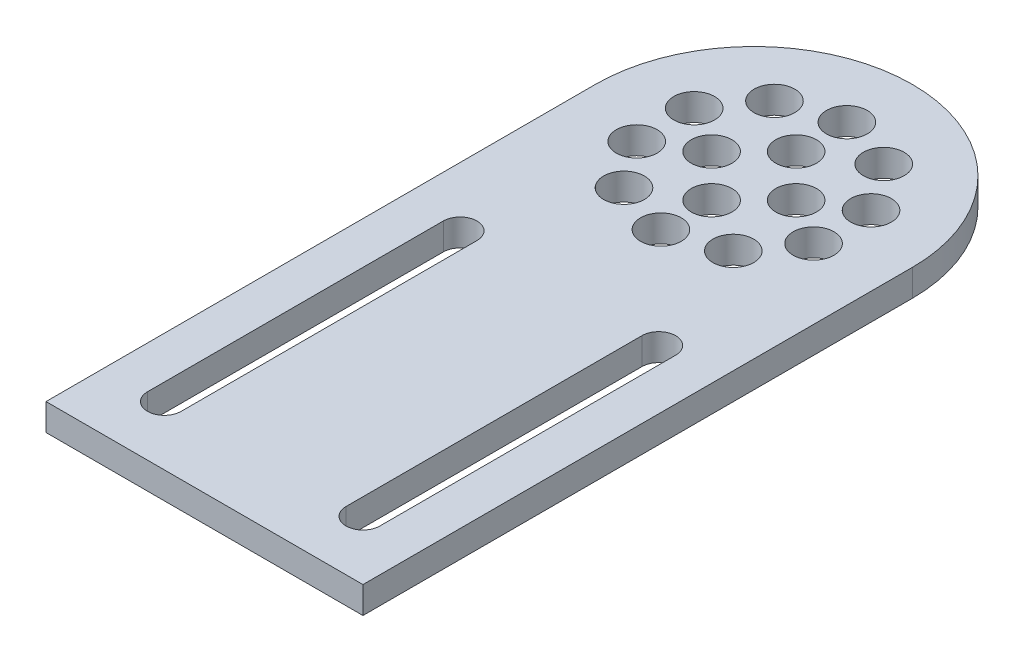
from build123d import *

# Parameters (mm, degrees)
SKETCH1_R           = 4.825
BOSS_EXTRUDE1_DEPTH = 6.35
CUT_EXTRUDE1_DEPTH  = 136.449520117


with BuildPart() as part:
    # Sketch1 → Boss-Extrude1 (new body)
    with BuildSketch(Plane(origin=(0, 0, 0), x_dir=(1, 0, 0), z_dir=(0, 1, 0))):
        with BuildLine():
            Line((-37.5, 0), (-37.5, -130))
            Line((-37.5, -130), (37.5, -130))
            Line((37.5, -130), (37.5, 0))
            ThreePointArc((37.5, 0), (0, 37.5), (-37.5, 0))
        make_face()
        with Locations(Location((0, 22, 0), (0, 0, 270))):
            Circle(SKETCH1_R, mode=Mode.SUBTRACT)
        with Locations(Location((0, 10, 0), (0, 0, 270))):
            Circle(SKETCH1_R, mode=Mode.SUBTRACT)
        with Locations(Location((12.93127555, 17.798373876, 0), (0, 0, 270))):
            Circle(SKETCH1_R, mode=Mode.SUBTRACT)
        with Locations(Location((20.923243358, 6.798373876, 0), (0, 0, 270))):
            Circle(SKETCH1_R, mode=Mode.SUBTRACT)
        with Locations(Location((20.923243358, -6.798373876, 0), (0, 0, 270))):
            Circle(SKETCH1_R, mode=Mode.SUBTRACT)
        with Locations(Location((12.93127555, -17.798373876, 0), (0, 0, 270))):
            Circle(SKETCH1_R, mode=Mode.SUBTRACT)
        with Locations(Location((0, -22, 0), (0, 0, 270))):
            Circle(SKETCH1_R, mode=Mode.SUBTRACT)
        with Locations(Location((-12.93127555, -17.798373876, 0), (0, 0, 270))):
            Circle(SKETCH1_R, mode=Mode.SUBTRACT)
        with Locations(Location((-20.923243358, -6.798373876, 0), (0, 0, 270))):
            Circle(SKETCH1_R, mode=Mode.SUBTRACT)
        with Locations(Location((-20.923243358, 6.798373876, 0), (0, 0, 270))):
            Circle(SKETCH1_R, mode=Mode.SUBTRACT)
        with Locations(Location((-12.93127555, 17.798373876, 0), (0, 0, 270))):
            Circle(SKETCH1_R, mode=Mode.SUBTRACT)
        with Locations(Location((10, 0, 0), (0, 0, 270))):
            Circle(SKETCH1_R, mode=Mode.SUBTRACT)
        with Locations(Location((0, -10, 0), (0, 0, 270))):
            Circle(SKETCH1_R, mode=Mode.SUBTRACT)
        with Locations(Location((-10, 0, 0), (0, 0, 270))):
            Circle(SKETCH1_R, mode=Mode.SUBTRACT)
    extrude(amount=BOSS_EXTRUDE1_DEPTH)

    # Sketch2 → Cut-Extrude1 (cut, through all)
    with BuildSketch(Plane(origin=(0, 6.35, 0), x_dir=(1, 0, 0), z_dir=(0, 1, 0))):
        with BuildLine():
            Line((-27.5, -116), (-27.5, -46))
            ThreePointArc((-27.5, -46), (-23.5, -42), (-19.5, -46))
            Line((-19.5, -46), (-19.5, -116))
            ThreePointArc((-19.5, -116), (-23.5, -120), (-27.5, -116))
        make_face()
    cut_extrude1 = extrude(amount=-CUT_EXTRUDE1_DEPTH, mode=Mode.SUBTRACT)

    # Mirror1: Cut-Extrude1 across plane
    add(cut_extrude1.mirror(Plane(origin=(0, 0, 0), x_dir=(0, 0, 1), z_dir=(1, 0, 0))), mode=Mode.SUBTRACT)


solid = part.part
